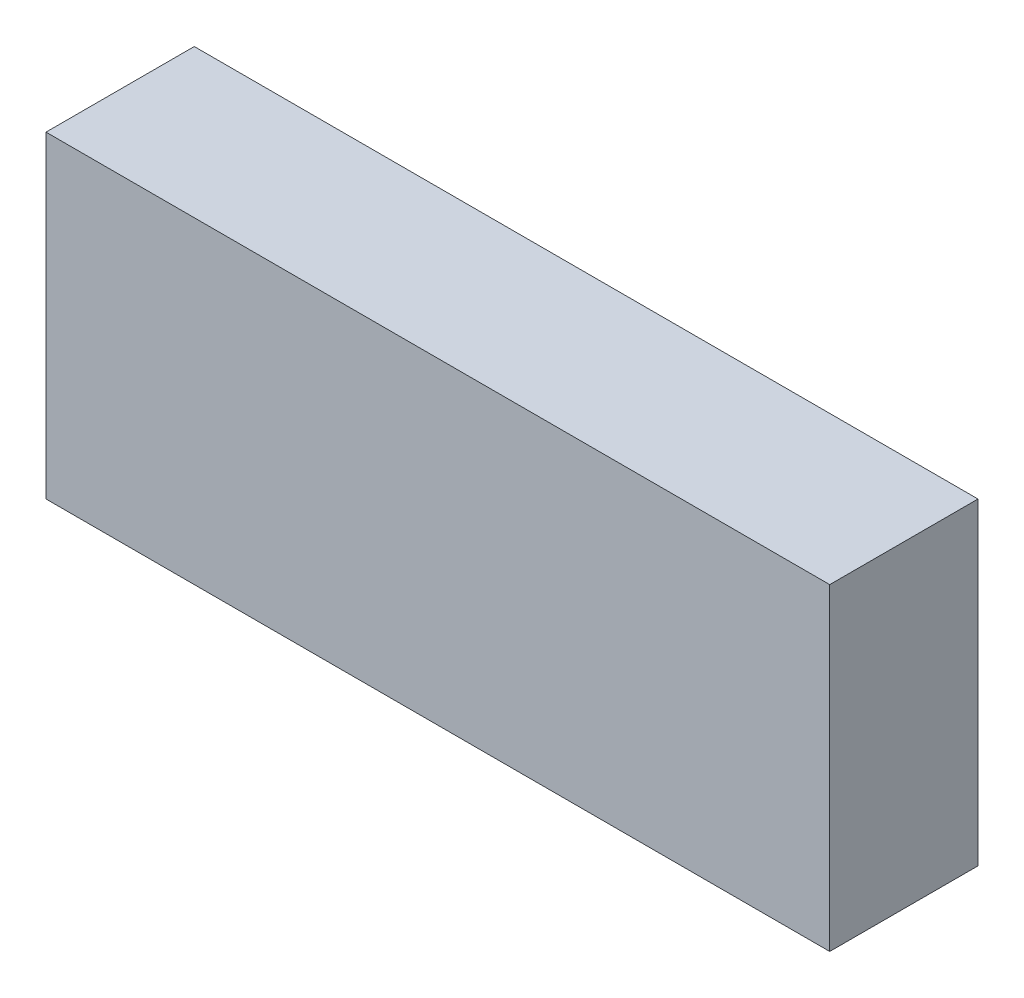
from build123d import *

# Parameters (mm, degrees)
SKETCH1_W           = 37
SKETCH1_H           = 15
BOSS_EXTRUDE1_DEPTH = 7


with BuildPart() as part:
    # Sketch1 → Boss-Extrude1 (new body)
    with BuildSketch(Plane.XY):
        with Locations((18.5, 7.5)):
            Rectangle(SKETCH1_W, SKETCH1_H)
    extrude(amount=BOSS_EXTRUDE1_DEPTH)


solid = part.part
